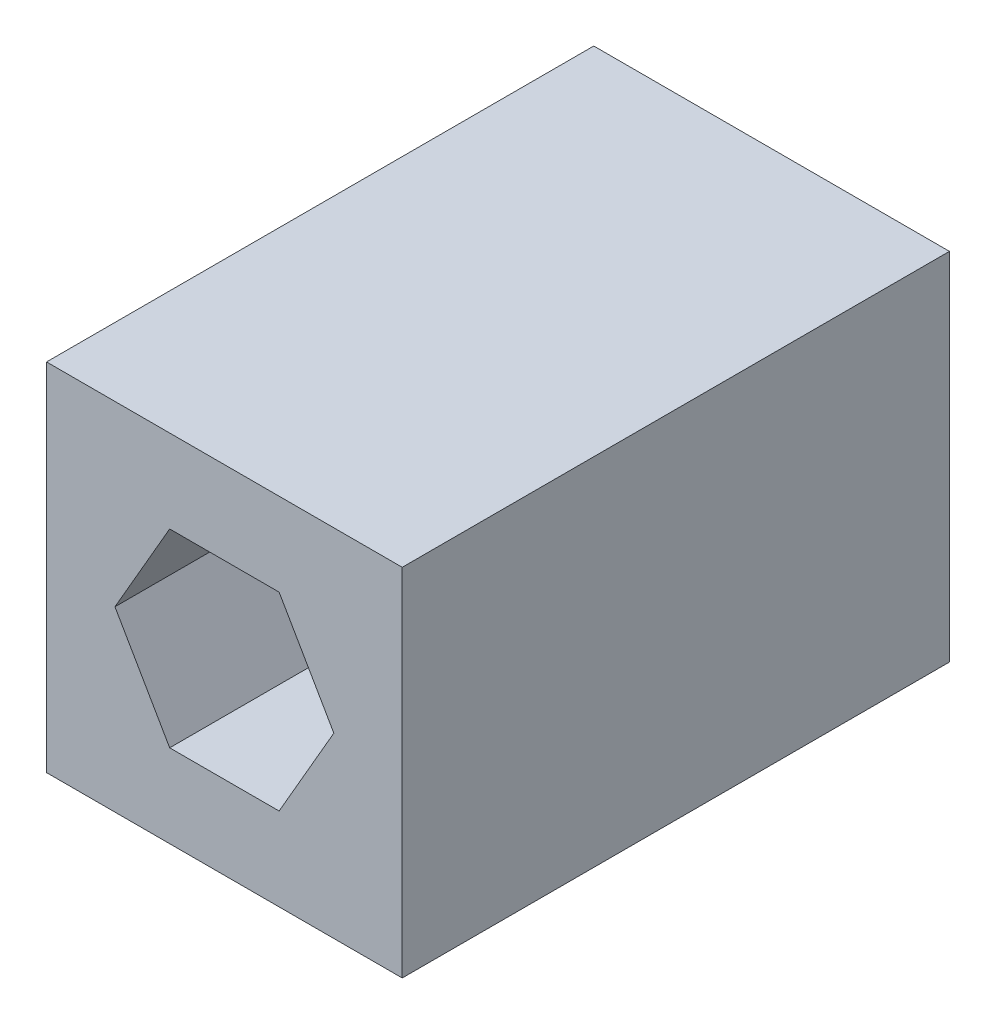
from build123d import *

# Parameters (mm, degrees)
SKETCH_2_W      = 130
SKETCH_2_H      = 130
EXTRUDE_2_DEPTH = 200


with BuildPart() as part:
    # 스케치2 → 보스-돌출2 (new body)
    with BuildSketch(Plane.XY):
        Rectangle(SKETCH_2_W, SKETCH_2_H)
        Polygon((20, 34.641016151), (-20, 34.641016151), (-40, 0), (-20, -34.641016151), (20, -34.641016151), (40, 0), align=None, mode=Mode.SUBTRACT)
    extrude(amount=EXTRUDE_2_DEPTH)


solid = part.part
